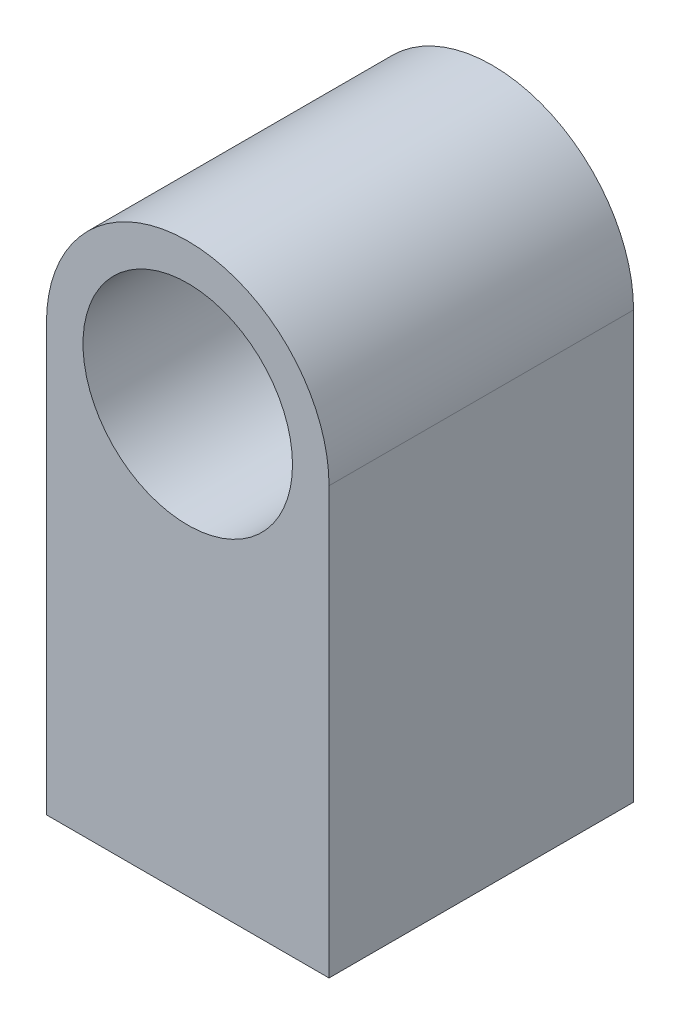
from build123d import *

# Parameters (mm, degrees)
CROQUIS1_R              = 8.6
SALIENTE_EXTRUIR1_DEPTH = 12.5
CROQUIS3_W              = 23.2
CROQUIS3_H              = 25
CROQUIS3_R              = 8.6
SALIENTE_EXTRUIR2_DEPTH = 25


with BuildPart() as part:
    # Croquis1 → Saliente-Extruir1 (new, symmetric)
    with BuildSketch(Plane.XY):
        with BuildLine():
            Line((-11.6, -10), (11.6, -10))
            Line((11.6, -10), (11.6, 0))
            ThreePointArc((11.6, 0), (0, 11.6), (-11.6, 0))
            Line((-11.6, 0), (-11.6, -10))
        make_face()
        Circle(CROQUIS1_R, mode=Mode.SUBTRACT)
    extrude(amount=SALIENTE_EXTRUIR1_DEPTH, both=True)

    # Croquis3 → Saliente-Extruir2 (add)
    with BuildSketch(Plane(origin=(0, -10, 0), x_dir=(-1, 0, 0), z_dir=(0, -1, 0))):
        Rectangle(CROQUIS3_W, CROQUIS3_H)
        with Locations(Location((0, 0, 0), (0, 0, 90))):
            Circle(CROQUIS3_R, mode=Mode.SUBTRACT)
    extrude(amount=SALIENTE_EXTRUIR2_DEPTH)


solid = part.part
